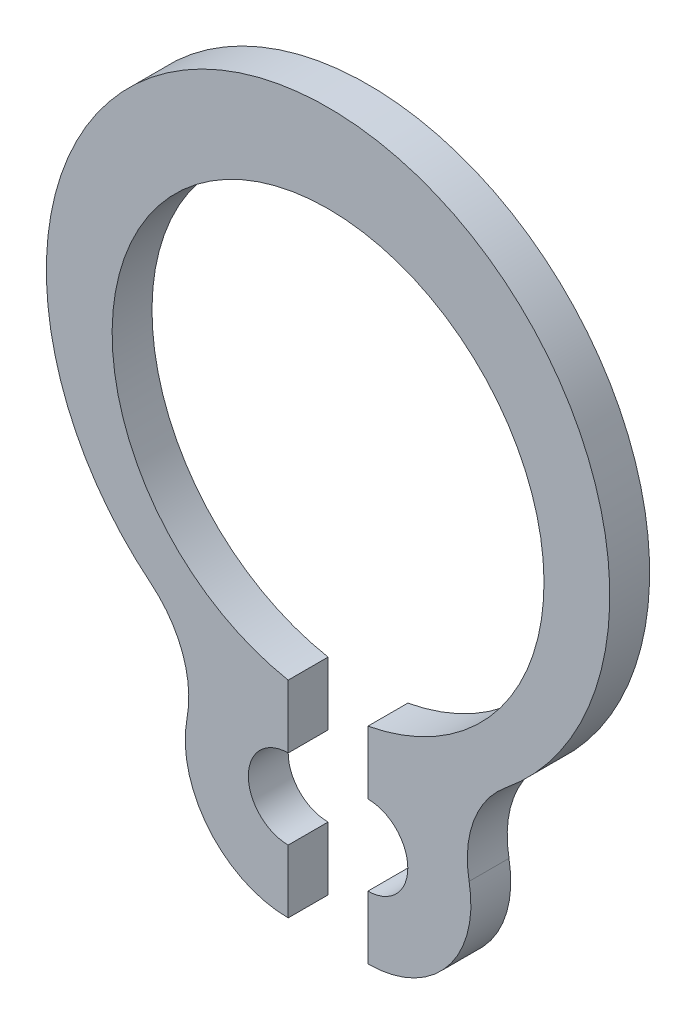
from build123d import *

# Parameters (mm, degrees)
BODY_DEPTH = 0.6


with BuildPart() as part:
    # Sketch1 → Body (new body)
    with BuildSketch(Plane.XY):
        with BuildLine():
            Line((-0.6, -3.524135251), (-0.6, -4.474135251))
            ThreePointArc((-0.6, -4.474135251), (-1.2, -5.074135251), (-0.6, -5.674135251))
            Line((-0.6, -5.674135251), (-0.6, -6.624135251))
            ThreePointArc((-0.6, -6.624135251), (-1.793543395, -6.063050901), (-2.122985475, -4.786011591))
            ThreePointArc((-2.122985475, -4.786011591), (-2.190649776, -3.964464757), (-2.669933821, -3.293790125))
            ThreePointArc((-2.669933821, -3.293790125), (0, 4.24), (2.669933821, -3.293790125))
            ThreePointArc((2.669933821, -3.293790125), (2.190649776, -3.964464757), (2.122985475, -4.786011591))
            ThreePointArc((2.122985475, -4.786011591), (1.793543395, -6.063050901), (0.6, -6.624135251))
            Line((0.6, -6.624135251), (0.6, -5.674135251))
            ThreePointArc((0.6, -5.674135251), (1.2, -5.074135251), (0.6, -4.474135251))
            Line((0.6, -4.474135251), (0.6, -3.524135251))
            ThreePointArc((0.6, -3.524135251), (0, 2.92), (-0.6, -3.524135251))
        make_face()
    extrude(amount=-BODY_DEPTH)


solid = part.part
